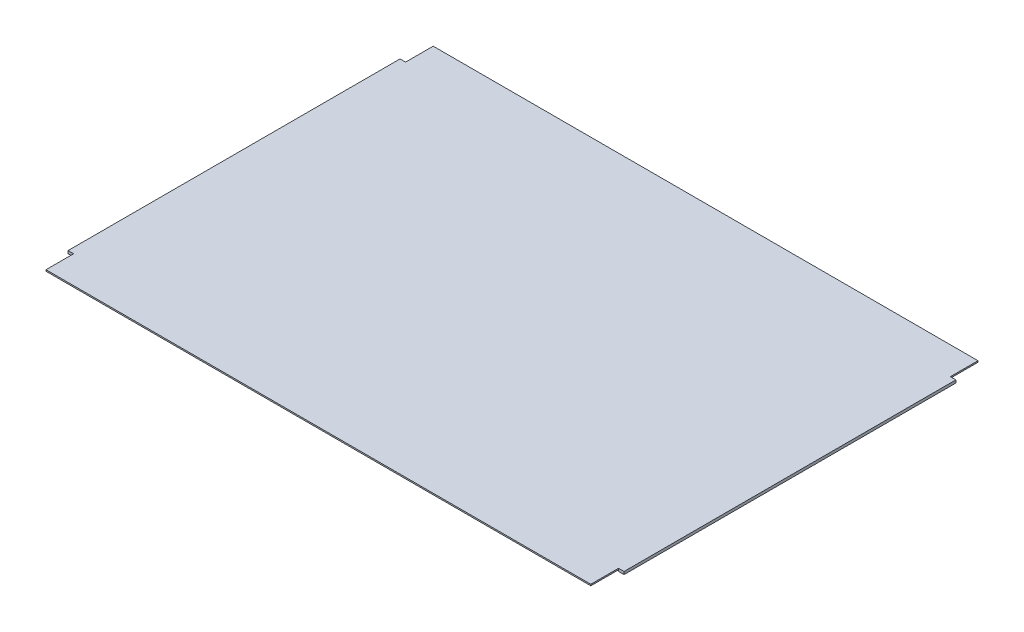
from build123d import *

# Parameters (mm, degrees)
EXTRUDE_1_DEPTH     = 1
SKETCH_4_W          = 197
SKETCH_4_H          = 140
CUT_EXTRUDE_3_DEPTH = 0.5


with BuildPart() as part:
    # 草图1 → 凸台-拉伸1 (new body)
    with BuildSketch(Plane(origin=(0, 0, 0), x_dir=(1, 0, 0), z_dir=(0, 1, 0))):
        Polygon((-98.5, 60), (-100.5, 60), (-100.5, -60), (-98.5, -60), (-98.5, -70), (98.5, -70), (98.5, -60), (100.5, -60), (100.5, 60), (98.5, 60), (98.5, 70), (-98.5, 70), align=None)
    extrude(amount=EXTRUDE_1_DEPTH)

    # 草图4 → 切除-拉伸3 (cut)
    with BuildSketch(Plane(origin=(0, 0, 0), x_dir=(1, 0, 0), z_dir=(0, 1, 0))):
        Rectangle(SKETCH_4_W, SKETCH_4_H)
    extrude(amount=CUT_EXTRUDE_3_DEPTH, mode=Mode.SUBTRACT)


solid = part.part
